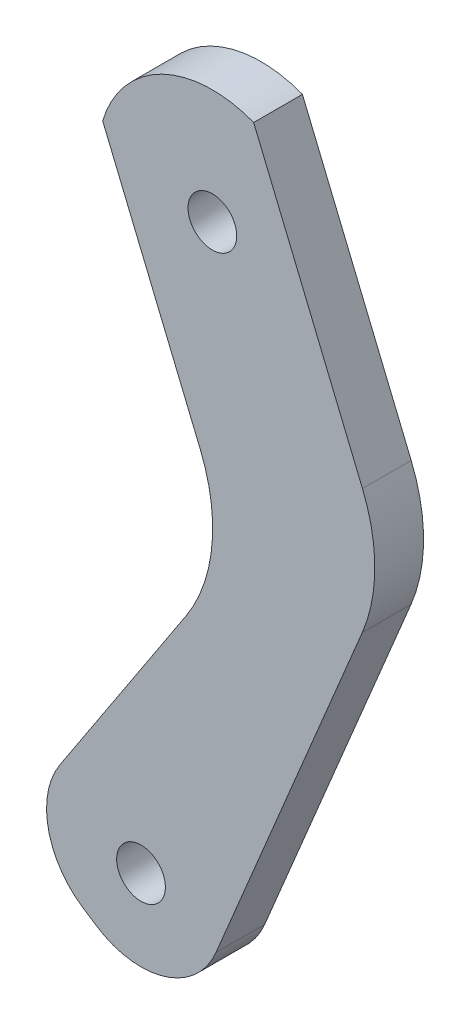
from build123d import *

# Parameters (mm, degrees)
SKETCH_1_R          = 18
LASHENA_DEPTH       = 30
CUT_EXTRUDEA_DEPTH  = 30
WWW_KYTOOL_CN_COUNT = 16
SKETCH_3_W          = 35.542909486
SKETCH_3_H          = 27
CUT_EXTRUDE_2_DEPTH = 30
SKETCH_4_R          = 1.5
CUT_EXTRUDE_3_DEPTH = 60
SKETCH_5_R          = 1.5
EXTRUDE_3_DEPTH     = 3
CUT_EXTRUDE_5_DEPTH = 3


with BuildPart() as part:
    # 草图1 → LaShenA (new body)
    with BuildSketch(Plane.XY):
        Circle(SKETCH_1_R)
    extrude(amount=LASHENA_DEPTH)

    # SketchA → Cut-ExtrudeA (cut)
    with BuildSketch(Plane.XY.offset(30)):
        with BuildLine():
            ThreePointArc((0.423212707, 13.493364703), (0, 13.5), (-0.423212707, 13.493364703))
            ThreePointArc((-0.423212707, 13.493364703), (-0.952770902, 13.685686791), (-1.20440395, 14.18977059))
            add(Edge.make_bspline(
                [(-1.20440395, 14.18977059), (-1.226562505, 14.455224305), (-1.213843633, 14.773889884), (-1.273675597, 15.110607864), (-1.299119688, 15.21139578), (-1.321432077, 15.29109757), (-1.349914152, 15.382250837), (-1.385146673, 15.484587535), (-1.427834192, 15.597770763), (-1.478623281, 15.721446817), (-1.538159915, 15.855229004), (-1.607069773, 15.998703507), (-1.685962928, 16.151428337), (-1.775430978, 16.312934487), (-1.876046532, 16.482726463), (-1.98836201, 16.660283053), (-2.112908684, 16.845058076), (-2.250195688, 17.036481179), (-2.400709063, 17.233958676), (-2.56491084, 17.43687441), (-2.743238138, 17.644590662), (-2.936102365, 17.856449073), (-3.14388814, 18.07177164), (-3.447378451, 18.368492697), (-3.689495989, 18.585006365), (-3.858042439, 18.727457792)],
                knots=[0.122308221, 0.122308221, 0.122308221, 0.122308221, 0.250610689, 0.276296194, 0.287604067, 0.300967916, 0.316387742, 0.333863545, 0.353395324, 0.37498308, 0.398626813, 0.424326522, 0.452082207, 0.48189387, 0.513761509, 0.547685125, 0.583664717, 0.621700286, 0.661791832, 0.703939355, 0.748142854, 0.79440233, 0.842717782, 0.893089212, 1, 1, 1, 1], degree=3))
            ThreePointArc((-3.858042439, 18.727457792), (0, 19.120726106), (3.858042439, 18.727457792))
            add(Edge.make_bspline(
                [(1.20440395, 14.18977059), (1.226562505, 14.455224305), (1.213843633, 14.773889884), (1.273675597, 15.110607864), (1.299119688, 15.21139578), (1.321432077, 15.29109757), (1.349914152, 15.382250837), (1.385146673, 15.484587535), (1.427834192, 15.597770763), (1.478623281, 15.721446817), (1.538159915, 15.855229004), (1.607069773, 15.998703507), (1.685962928, 16.151428337), (1.775430978, 16.312934487), (1.876046532, 16.482726463), (1.98836201, 16.660283053), (2.112908684, 16.845058076), (2.250195688, 17.036481179), (2.400709063, 17.233958676), (2.56491084, 17.43687441), (2.743238138, 17.644590662), (2.936102365, 17.856449073), (3.14388814, 18.07177164), (3.447378451, 18.368492697), (3.689495989, 18.585006365), (3.858042439, 18.727457792)],
                knots=[0.122308221, 0.122308221, 0.122308221, 0.122308221, 0.250610689, 0.276296194, 0.287604067, 0.300967916, 0.316387742, 0.333863545, 0.353395324, 0.37498308, 0.398626813, 0.424326522, 0.452082207, 0.48189387, 0.513761509, 0.547685125, 0.583664717, 0.621700286, 0.661791832, 0.703939355, 0.748142854, 0.79440233, 0.842717782, 0.893089212, 1, 1, 1, 1], degree=3))
            ThreePointArc((1.20440395, 14.18977059), (0.952770902, 13.685686791), (0.423212707, 13.493364703))
        make_face()
    cut_extrudea = extrude(amount=-CUT_EXTRUDEA_DEPTH, mode=Mode.SUBTRACT)

    # www.KYTool.cn: Cut-ExtrudeA ×16 about axis
    www_kytool_cn_axis = Axis((0, 0, -80.9), (0, 0, 1))
    for i in range(1, WWW_KYTOOL_CN_COUNT):
        add(cut_extrudea.rotate(www_kytool_cn_axis, i * 360 / WWW_KYTOOL_CN_COUNT), mode=Mode.SUBTRACT)

    # 草图3 → 切除-拉伸2 (cut, symmetric)
    with BuildSketch(Plane(origin=(0, 0, 0), x_dir=(1, 0, 0), z_dir=(0, 1, 0))):
        with Locations((0, -13.5)):
            Rectangle(SKETCH_3_W, SKETCH_3_H)
    extrude(amount=CUT_EXTRUDE_2_DEPTH, both=True, mode=Mode.SUBTRACT)

    # 草图4 → 切除-拉伸3 (cut)
    with BuildSketch(Plane.XY.offset(30)):
        Circle(SKETCH_4_R)
    extrude(amount=-CUT_EXTRUDE_3_DEPTH, mode=Mode.SUBTRACT)

    # 草图5 → 凸台-拉伸3 (add)
    with BuildSketch(Plane.XY.offset(30)):
        with BuildLine():
            Line((15.280220873, -61.835446614), (7.518552247, -73.648578352))
            ThreePointArc((7.518552247, -73.648578352), (6.801054577, -77.407548694), (8.951700529, -80.572889581))
            Line((8.951700529, -80.572889581), (9.765341245, -81.107481911))
            ThreePointArc((9.765341245, -81.107481911), (13.973775635, -81.709971806), (17.124630908, -78.855847572))
            Line((17.124630908, -78.855847572), (26.13082512, -57.293888764))
            ThreePointArc((26.13082512, -57.293888764), (26.903397768, -53.454512274), (26.142204066, -49.612863608))
            Line((26.142204066, -49.612863608), (9.545941546, -9.545941546))
            Line((9.545941546, -9.545941546), (0, -13.5))
            Line((0, -13.5), (16.161556687, -52.517449343))
            ThreePointArc((16.161556687, -52.517449343), (16.878328365, -57.285923538), (15.280220873, -61.835446614))
        make_face()
        with Locations((16.903408741, -40.017494037)):
            Circle(SKETCH_5_R, mode=Mode.SUBTRACT)
        with Locations((12.510922719, -76.928752156)):
            Circle(SKETCH_5_R, mode=Mode.SUBTRACT)
    extrude(amount=-EXTRUDE_3_DEPTH)

    # 草图8 → 切除-拉伸5 (cut)
    with BuildSketch(Plane.XY.offset(30)):
        with BuildLine():
            Line((-47.449101502, -4.18243968), (9.857223077, -40.017494037))
            ThreePointArc((9.857223077, -40.017494037), (14.412678985, -33.42621209), (22.188716957, -35.357638944))
            Line((22.188716957, -35.357638944), (66.6397739, 3.833166133))
            Line((66.6397739, 3.833166133), (-5.431022365, 32.995833694))
            Line((-5.431022365, 32.995833694), (-47.449101502, -4.18243968))
        make_face()
    extrude(amount=-CUT_EXTRUDE_5_DEPTH, mode=Mode.SUBTRACT)


solid = part.part
